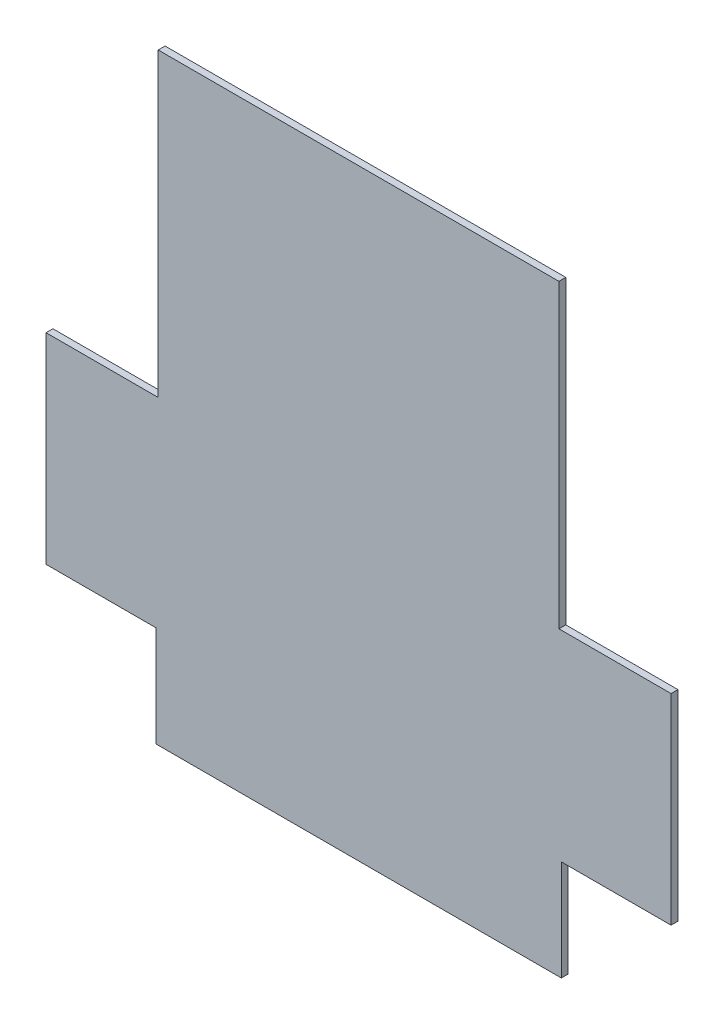
from build123d import *

# Parameters (mm, degrees)
SKETCH1_W           = 273.4
SKETCH1_H           = 263.4
BOSS_EXTRUDE1_DEPTH = 3
SKETCH2_W           = 49.05
SKETCH2_H           = 131.64
SKETCH2_W_2         = 48
SKETCH2_H_2         = 44
CUT_EXTRUDE1_DEPTH  = 380.652630703


with BuildPart() as part:
    # Sketch1 → Boss-Extrude1 (new body)
    with BuildSketch(Plane.XY):
        with Locations((136.7, -131.7)):
            Rectangle(SKETCH1_W, SKETCH1_H)
    extrude(amount=BOSS_EXTRUDE1_DEPTH)

    # Sketch2 → Cut-Extrude1 (cut, through all)
    with BuildSketch(Plane.XY.offset(3)):
        with Locations((24.525, -65.82)):
            Rectangle(SKETCH2_W, SKETCH2_H)
        with Locations((24, -241.4)):
            Rectangle(SKETCH2_W_2, SKETCH2_H_2)
        with Locations((248.875, -65.82)):
            Rectangle(SKETCH2_W, SKETCH2_H)
        with Locations((249.4, -241.4)):
            Rectangle(SKETCH2_W_2, SKETCH2_H_2)
    extrude(amount=-CUT_EXTRUDE1_DEPTH, mode=Mode.SUBTRACT)


solid = part.part
